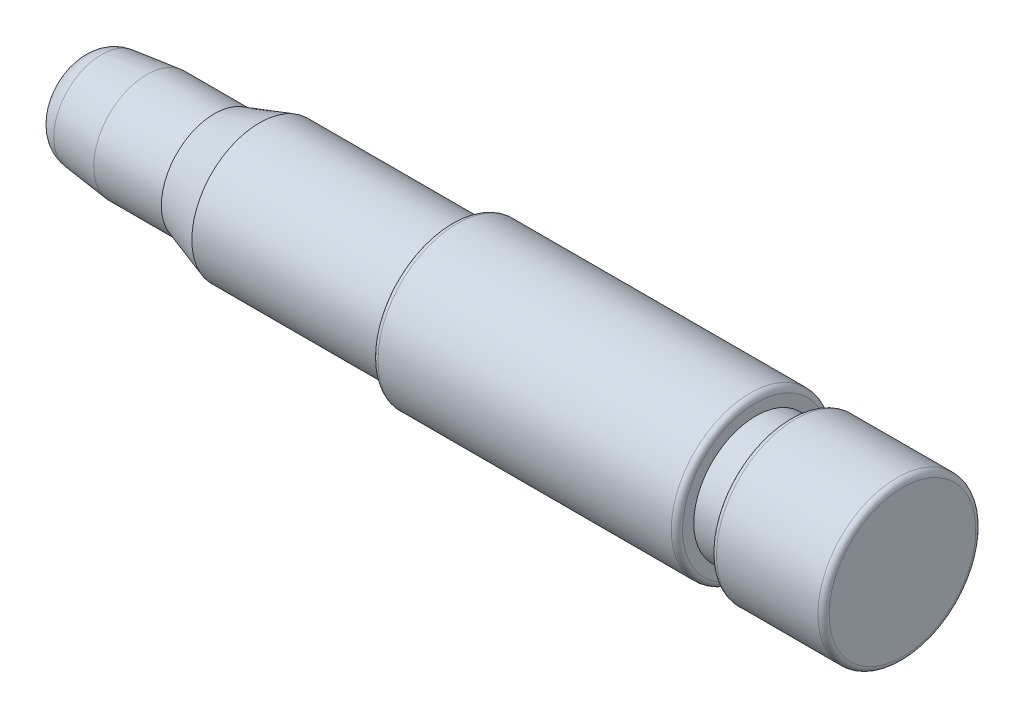
from build123d import *

# Parameters (mm, degrees)
ESBO_O2_R             = 1.5
CORTE_EXTRUS_O1_DEPTH = 3
FILETE1_R             = 2.25
FILETE2_R             = 0.5


with BuildPart() as part:
    # Esboço1 → Revolução1 (revolve)
    with BuildSketch(Plane.XY, mode=Mode.PRIVATE) as revolu_o1_sk:
        Polygon((0, 0), (73, 0), (73, 7), (63, 7), (63, 5.5), (60, 5.5), (60, 7), (33, 7), (33, 6), (16, 6), (12, 4.7), (6, 4.7), (0, 4), align=None)
    revolve(revolu_o1_sk.sketch.rotate(Axis((0, 0, 0), (1, 0, 0)), 90), axis=Axis((0, 0, 0), (1, 0, 0)))

    # Esboço2 → Corte-extrusão1 (cut)
    with BuildSketch(Plane.ZY):
        Circle(ESBO_O2_R)
    extrude(amount=-CORTE_EXTRUS_O1_DEPTH, mode=Mode.SUBTRACT)

    # Filete1
    filete1_edges = [part.edges().sort_by_distance(p)[0] for p in [
        (0, 0, -4),
    ]]
    fillet(filete1_edges, radius=FILETE1_R)

    # Filete2
    filete2_edges = [part.edges().sort_by_distance(p)[0] for p in [
        (33, 0, -7),
        (60, 0, -7),
        (63, 0, -7),
        (73, 0, -7),
    ]]
    fillet(filete2_edges, radius=FILETE2_R)


solid = part.part
